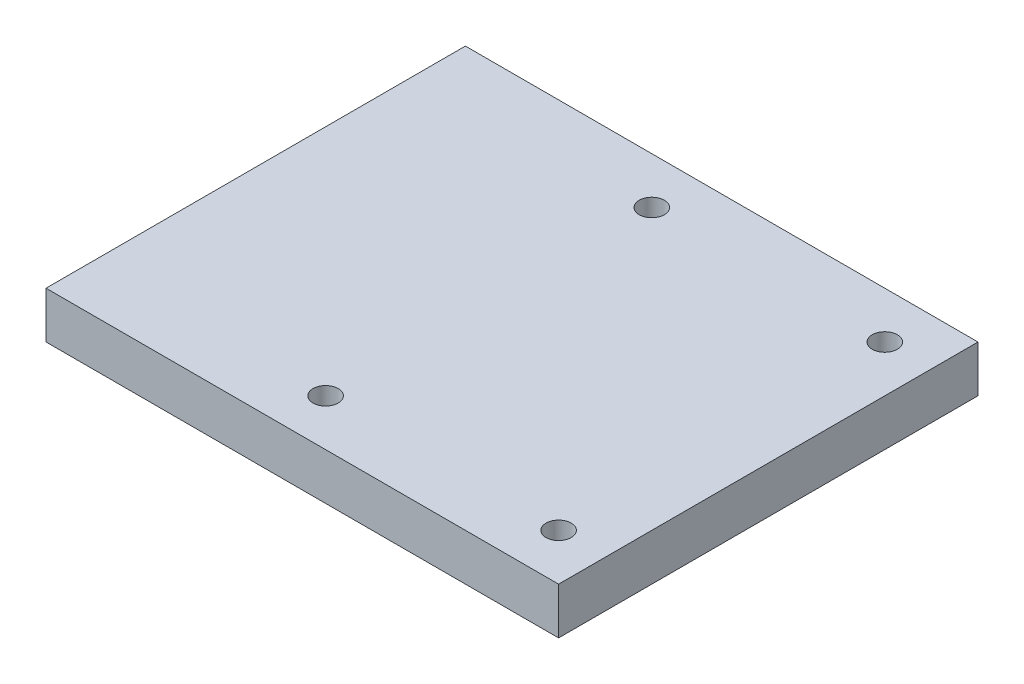
from build123d import *

# Parameters (mm, degrees)
SKETCH1_W           = 139.7
SKETCH1_H           = 114.3
BOSS_EXTRUDE1_DEPTH = 12.7
CUT_EXTRUDE2_REACH  = 93.14
SKETCH3_R           = 3.429
SKETCH4_R           = 12.7
CUT_EXTRUDE3_DEPTH  = 7.874


with BuildPart() as part:
    # Sketch1 → Boss-Extrude1 (new body)
    with BuildSketch(Plane(origin=(0, 0, 0), x_dir=(1, 0, 0), z_dir=(0, 1, 0))):
        Rectangle(SKETCH1_W, SKETCH1_H)
    extrude(amount=BOSS_EXTRUDE1_DEPTH)

    # Sketch3 → Cut-Extrude2 (cut, up to next)
    with BuildSketch(Plane.XZ, mode=Mode.PRIVATE) as cut_extrude2_sk1:
        with Locations(Location((-6.35, 44.45, 0), (0, 0, 270))):
            Circle(SKETCH3_R)
    cut_extrude2_tool1 = extrude(cut_extrude2_sk1.sketch, amount=-CUT_EXTRUDE2_REACH, mode=Mode.PRIVATE) & part.part
    # Sketch3 → Cut-Extrude2 (cut, up to next)
    with BuildSketch(Plane.XZ, mode=Mode.PRIVATE) as cut_extrude2_sk2:
        with Locations(Location((-6.35, -44.45, 0), (0, 0, 90))):
            Circle(SKETCH3_R)
    cut_extrude2_tool2 = extrude(cut_extrude2_sk2.sketch, amount=-CUT_EXTRUDE2_REACH, mode=Mode.PRIVATE) & part.part
    # Sketch3 → Cut-Extrude2 (cut, up to next)
    with BuildSketch(Plane.XZ, mode=Mode.PRIVATE) as cut_extrude2_sk3:
        with Locations(Location((57.15, 44.45, 0), (0, 0, 90))):
            Circle(SKETCH3_R)
    cut_extrude2_tool3 = extrude(cut_extrude2_sk3.sketch, amount=-CUT_EXTRUDE2_REACH, mode=Mode.PRIVATE) & part.part
    # Sketch3 → Cut-Extrude2 (cut, up to next)
    with BuildSketch(Plane.XZ, mode=Mode.PRIVATE) as cut_extrude2_sk4:
        with Locations(Location((57.15, -44.45, 0), (0, 0, 270))):
            Circle(SKETCH3_R)
    cut_extrude2_tool4 = extrude(cut_extrude2_sk4.sketch, amount=-CUT_EXTRUDE2_REACH, mode=Mode.PRIVATE) & part.part
    add(cut_extrude2_tool1.solids().sort_by_distance((-6.35, 0, 44.45))[0], mode=Mode.SUBTRACT)
    add(cut_extrude2_tool2.solids().sort_by_distance((-6.35, 0, -44.45))[0], mode=Mode.SUBTRACT)
    add(cut_extrude2_tool3.solids().sort_by_distance((57.15, 0, 44.45))[0], mode=Mode.SUBTRACT)
    add(cut_extrude2_tool4.solids().sort_by_distance((57.15, 0, -44.45))[0], mode=Mode.SUBTRACT)

    # Sketch4 → Cut-Extrude3 (cut)
    with BuildSketch(Plane.XZ):
        with Locations(Location((-53.975, 0, 0), (0, 0, 270))):
            Circle(SKETCH4_R)
    extrude(amount=-CUT_EXTRUDE3_DEPTH, mode=Mode.SUBTRACT)


solid = part.part
